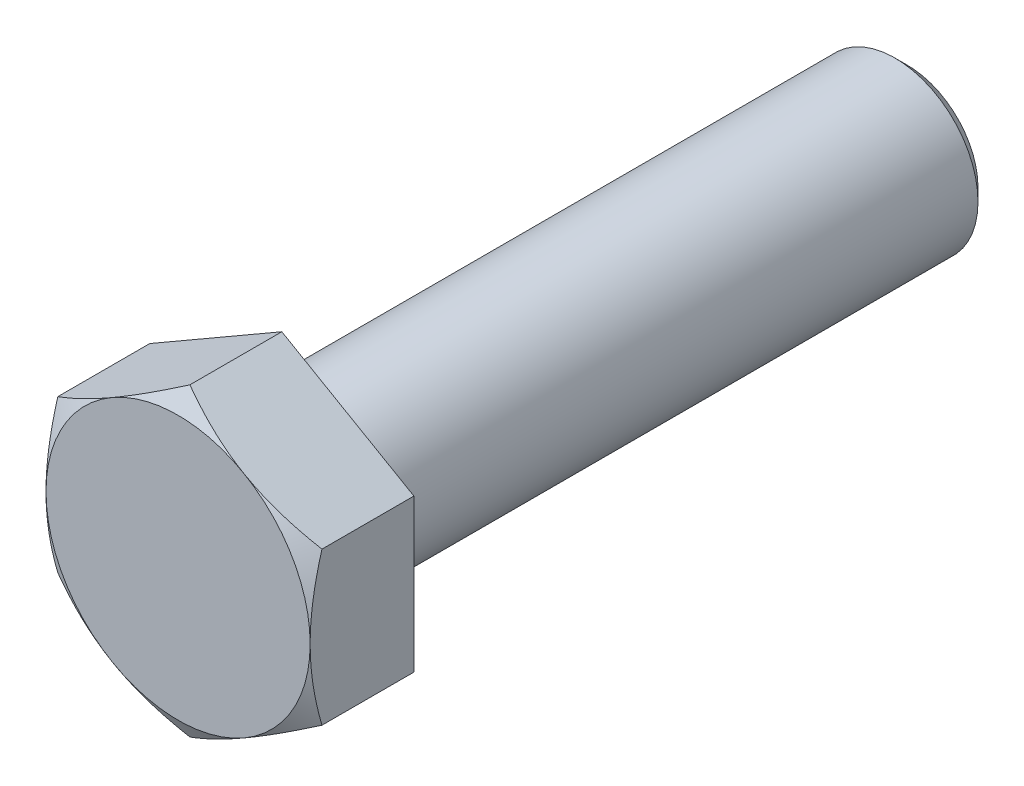
from build123d import *

# Parameters (mm, degrees)
BOSS_EXTRUDE1_DEPTH = 5.15


with BuildPart() as part:
    # Sketch1 → Boss-Extrude1 (new body)
    with BuildSketch(Plane.XY):
        Polygon((0, 7.349668927), (-6.365, 3.674834463), (-6.365, -3.674834463), (0, -7.349668927), (6.365, -3.674834463), (6.365, 3.674834463), align=None)
    extrude(amount=BOSS_EXTRUDE1_DEPTH)

    # Sketch2 → Revolve1 (revolve)
    with BuildSketch(Plane(origin=(0, 0, 0), x_dir=(0, 0, -1), z_dir=(1, 0, 0)), mode=Mode.PRIVATE) as revolve1_sk:
        with BuildLine():
            Line((0, 0), (0, 4.6))
            ThreePointArc((0, 4.6), (0.175735931, 4.175735931), (0.6, 4))
            Line((0.6, 4), (29.4, 4))
            Line((29.4, 4), (30, 3.4))
            Line((30, 3.4), (30, 0))
            Line((30, 0), (0, 0))
        make_face()
    revolve(revolve1_sk.sketch.rotate(Axis((0, 0, 0), (0, 0, -1)), 90), axis=Axis((0, 0, 0), (0, 0, -1)))

    # Sketch3 → Cut-Revolve1 (revolve, cut)
    with BuildSketch(Plane(origin=(0, 0, 0), x_dir=(0, 0, -1), z_dir=(1, 0, 0)), mode=Mode.PRIVATE) as cut_revolve1_sk:
        Polygon((-5.15, 7.349668927), (-4.58150113, 7.349668927), (-5.15, 6.365), align=None)
        Polygon((-0.15, 7.349668927), (-0.15, 5.88660254), (0, 5.8), (0, 7.349668927), align=None)
    revolve(cut_revolve1_sk.sketch.rotate(Axis((0, 0, 12.204941078), (0, 0, -1)), 90), axis=Axis((0, 0, 12.204941078), (0, 0, -1)), mode=Mode.SUBTRACT)


solid = part.part
